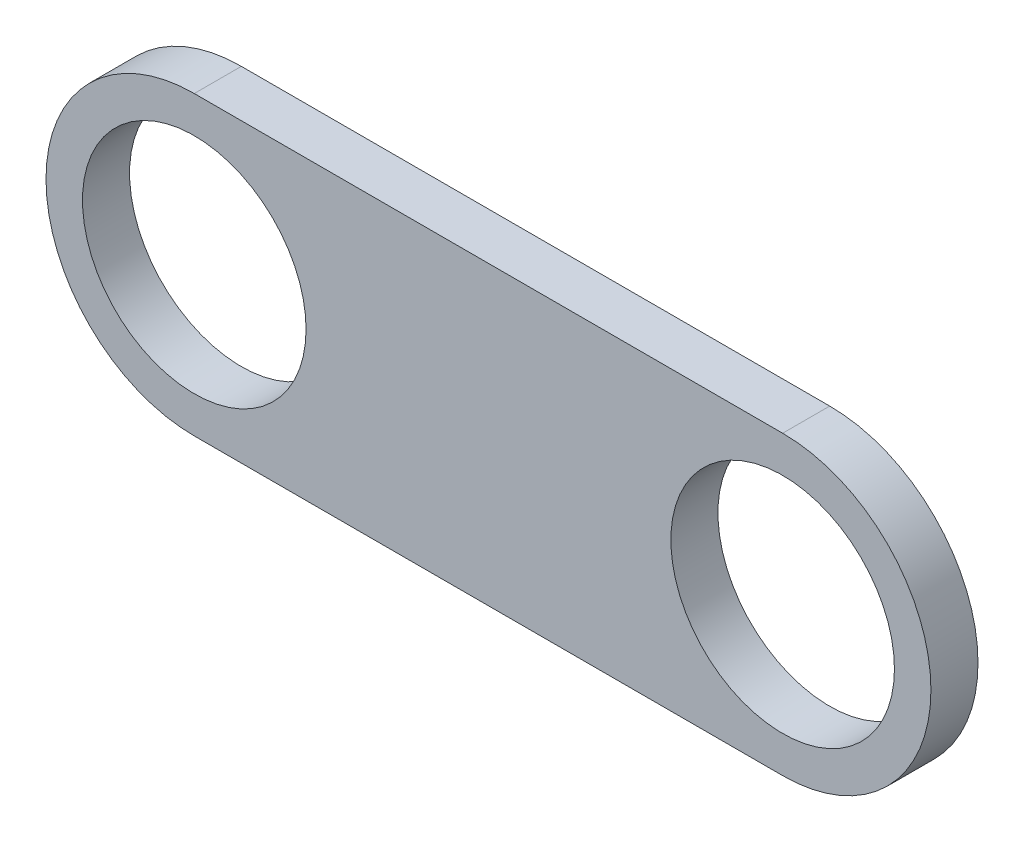
from build123d import *

# Parameters (mm, degrees)
SKETCH1_R           = 9.5
BOSS_EXTRUDE1_DEPTH = 4


with BuildPart() as part:
    # Sketch1 → Boss-Extrude1 (new body)
    with BuildSketch(Plane.XY):
        with BuildLine():
            Line((0, 12.6), (50, 12.6))
            ThreePointArc((50, 12.6), (62.6, 0), (50, -12.6))
            Line((50, -12.6), (0, -12.6))
            ThreePointArc((0, -12.6), (-12.6, 0), (0, 12.6))
        make_face()
        with Locations((50, 0)):
            Circle(SKETCH1_R, mode=Mode.SUBTRACT)
        Circle(SKETCH1_R, mode=Mode.SUBTRACT)
    extrude(amount=BOSS_EXTRUDE1_DEPTH)


solid = part.part
